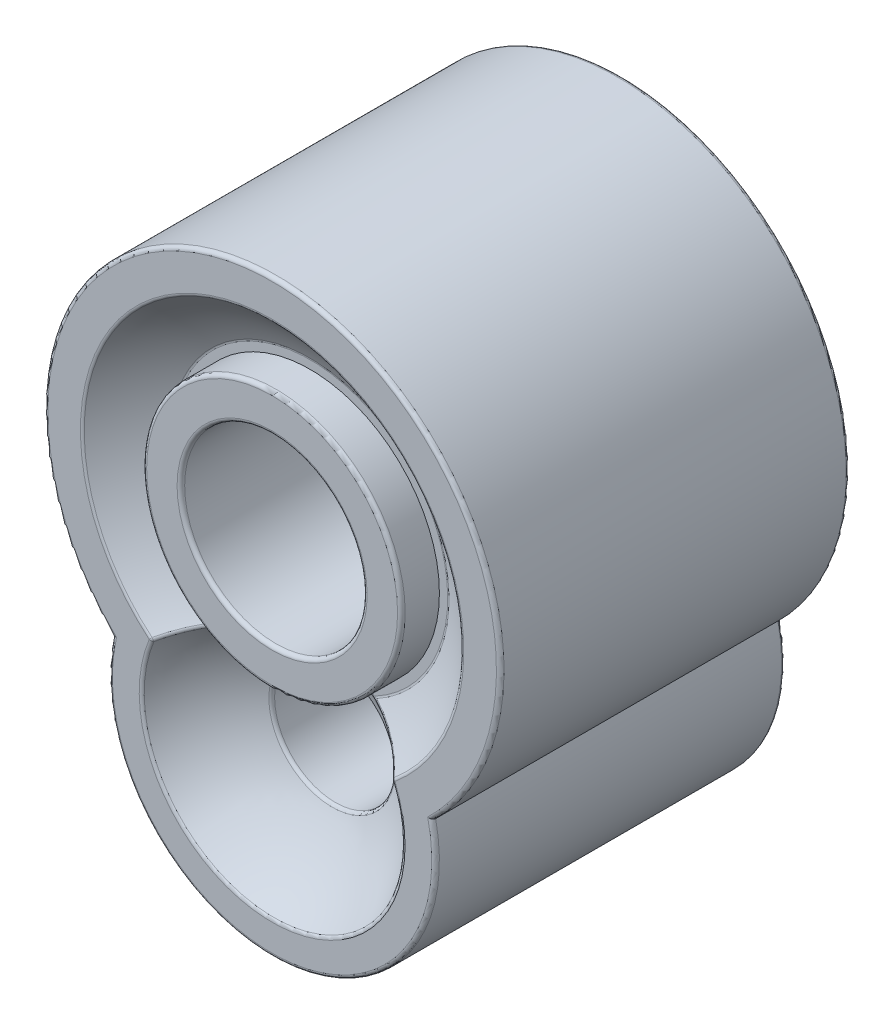
from build123d import *

# Parameters (mm, degrees)
EXTRUSION1_DEPTH = 9.2
SKETCH2_W        = 1
SKETCH2_H        = 1
EXTRUSION2_REACH = 16.522
SKETCH4_R        = 3.4
SKETCH4_R_2      = 2.4
FILLET1_R        = 0.1


with BuildPart() as part:
    # Sketch1 → Extrusion1 (new body)
    with BuildSketch(Plane.XY):
        with BuildLine():
            ThreePointArc((4.201227, -4.283654), (0, 6), (-4.201227, -4.283654))
            ThreePointArc((-4.201227, -4.283654), (0, -9.5), (4.201227, -4.283654))
        make_face()
    extrude(amount=-EXTRUSION1_DEPTH)

    # Sketch2 → Revolution1 (revolve, cut)
    with BuildSketch(Plane.YZ, mode=Mode.PRIVATE) as revolution1_sk:
        with BuildLine():
            Line((3.4, -1), (3.643, -1))
            ThreePointArc((3.643, -1), (4.360367, -0.552743), (5, 0))
            Line((5, 0), (3.4, 0))
            Line((3.4, 0), (3.4, -1))
        make_face()
        with Locations((2.9, -0.5)):
            Rectangle(SKETCH2_W, SKETCH2_H)
        Polygon((2.4, -1), (2.4, 0), (0, 0), (0, -8.8), (2.4, -8.8), align=None)
    revolve(revolution1_sk.sketch.rotate(Axis((0, 0, 0), (0, 0, -1)), 180), axis=Axis((0, 0, 0), (0, 0, -1)), mode=Mode.SUBTRACT)

    # Sketch3 → Revolution2 (revolve, cut)
    with BuildSketch(Plane.YZ, mode=Mode.PRIVATE) as revolution2_sk:
        with BuildLine():
            Line((-6.8, 0), (-8.64, 0))
            ThreePointArc((-8.64, 0), (-7.844889, -0.943623), (-6.8, -1.6))
            Line((-6.8, -1.6), (-6.8, 0))
        make_face()
        Polygon((-5.2, -8.8), (-5.2, 0), (-6.8, 0), (-6.8, -1.6), (-6.8, -8.8), align=None)
    revolve(revolution2_sk.sketch.rotate(Axis((0, -5.2, 0), (0, 0, -1)), 270), axis=Axis((0, -5.2, 0), (0, 0, -1)), mode=Mode.SUBTRACT)

    # Sketch4 → Extrusion2 (add, up to next)
    with BuildSketch(Plane.XY, mode=Mode.PRIVATE) as extrusion2_sk1:
        Circle(SKETCH4_R)
        with Locations(Location((0, 0, 0), (0, 0, 270))):
            Circle(SKETCH4_R_2, mode=Mode.SUBTRACT)
    extrusion2_tool1 = extrude(extrusion2_sk1.sketch, amount=-EXTRUSION2_REACH, mode=Mode.PRIVATE) - part.part
    add(extrusion2_tool1.solids().sort_by_distance((-3.303833, 0, 0))[0])

    # Fillet1
    fillet1_edges = [part.edges().sort_by_distance(p)[0] for p in [
        (-2.49259, -3.520067, -0.587098),
        (2.49259, -3.520067, -0.587098),
        (1.566356, -3.151641, -1),
        (-0.680444, -8.572031, 0),
        (-1.6, -5.2, -1.6),
        (-1.566356, -3.151641, -1),
        (-3.4, 0, 0),
        (0, 2.4, 0),
        (0, 6, 0),
        (0, -9.5, 0),
        (0, -9.5, -9.2),
        (0, 6, -9.2),
        (0, 3.643, -1),
        (0, 5, 0),
    ]]
    fillet(fillet1_edges, radius=FILLET1_R)


solid = part.part
